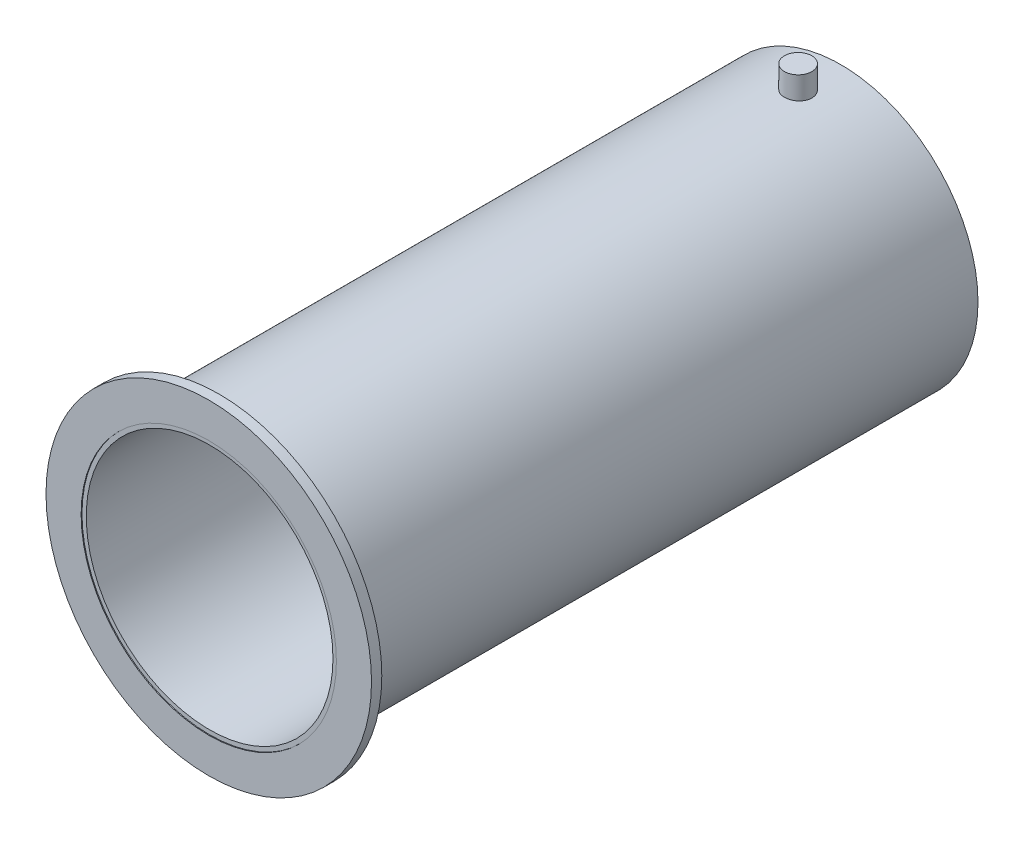
from build123d import *

# Parameters (mm, degrees)
SKETCH1_R                 = 16
SKETCH1_R_2               = 13
BOTTOM_RING_BAYONET_DEPTH = 8
SKETCH2_R                 = 16
SKETCH2_R_2               = 14.4
WELL_TUBE_DEPTH           = 65.7
SKETCH3_R                 = 19
SKETCH3_R_2               = 14.9
HATCH_FLANGE_DEPTH        = 1.2
SKETCH4_R                 = 1.6
BAYONET_PIN_STBD_DEPTH    = 3.6
SKETCH5_R                 = 1.6
BAYONET_PIN_PORT_DEPTH    = 3.6


with BuildPart() as part:
    # Sketch1 → Bottom_ring_bayonet (new body)
    with BuildSketch(Plane.XY.offset(-12)):
        with Locations((48, 0)):
            Circle(SKETCH1_R)
        with Locations((48, 0)):
            Circle(SKETCH1_R_2, mode=Mode.SUBTRACT)
    extrude(amount=BOTTOM_RING_BAYONET_DEPTH)

    # Sketch2 → Well_tube (add)
    with BuildSketch(Plane.XY.offset(-4)):
        with Locations((48, 0)):
            Circle(SKETCH2_R)
        with Locations((48, 0)):
            Circle(SKETCH2_R_2, mode=Mode.SUBTRACT)
    extrude(amount=WELL_TUBE_DEPTH)

    # Sketch3 → Hatch_flange (add)
    with BuildSketch(Plane.XY.offset(60.6)):
        with Locations((48, 0)):
            Circle(SKETCH3_R)
        with Locations((48, 0)):
            Circle(SKETCH3_R_2, mode=Mode.SUBTRACT)
    extrude(amount=HATCH_FLANGE_DEPTH)

    # Sketch4 → Bayonet_pin_stbd (add)
    with BuildSketch(Plane(origin=(0, 15, 0), x_dir=(1, 0, 0), z_dir=(0, 1, 0))):
        with Locations(Location((48, 7, 0), (0, 0, 90))):
            Circle(SKETCH4_R)
    extrude(amount=BAYONET_PIN_STBD_DEPTH)

    # Sketch5 → Bayonet_pin_port (add)
    with BuildSketch(Plane(origin=(0, -18.6, 0), x_dir=(1, 0, 0), z_dir=(0, 1, 0))):
        with Locations(Location((48, 7, 0), (0, 0, 90))):
            Circle(SKETCH5_R)
    extrude(amount=BAYONET_PIN_PORT_DEPTH)


solid = part.part
